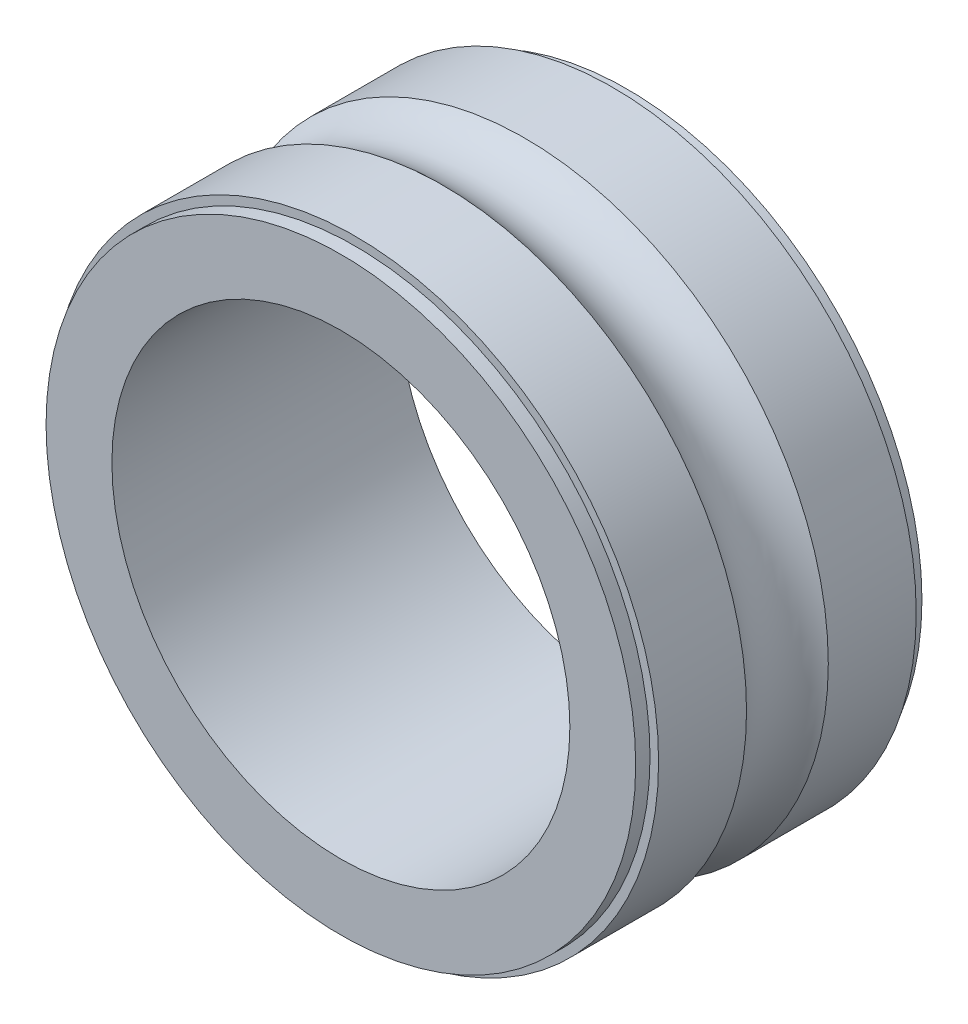
from build123d import *


with BuildPart() as part:
    # Sketch1 → Revolve1 (revolve)
    with BuildSketch(Plane(origin=(0, 0, 0), x_dir=(0, 0, -1), z_dir=(1, 0, 0)), mode=Mode.PRIVATE) as revolve1_sk:
        with BuildLine():
            Line((-2.5, 5.15), (-2.5, 4))
            Line((-2.5, 4), (2.5, 4))
            Line((2.5, 4), (2.5, 5.15))
            Line((2.5, 5.15), (2.25, 5.15))
            Line((2.25, 5.15), (2.25, 5.3))
            Line((2.25, 5.3), (0.714142843, 5.3))
            ThreePointArc((0.714142843, 5.3), (0, 5), (-0.714142843, 5.3))
            Line((-0.714142843, 5.3), (-2.25, 5.3))
            Line((-2.25, 5.3), (-2.25, 5.15))
            Line((-2.25, 5.15), (-2.5, 5.15))
        make_face()
    revolve(revolve1_sk.sketch.rotate(Axis((0, 0, 6.755399071), (0, 0, -1)), 90), axis=Axis((0, 0, 6.755399071), (0, 0, -1)))


solid = part.part
